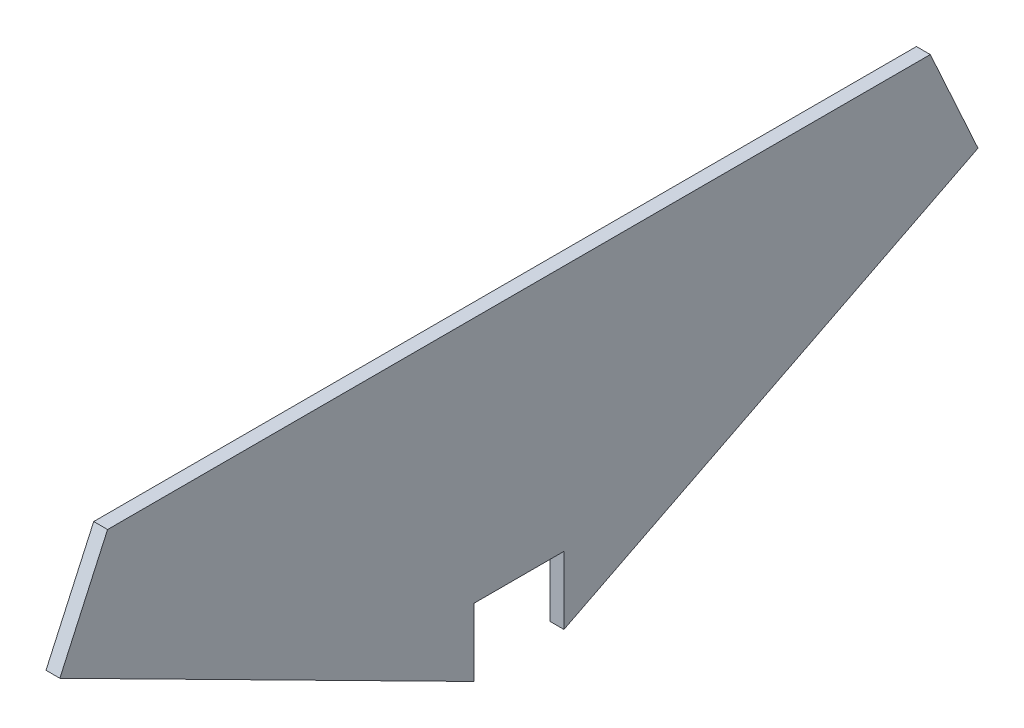
from build123d import *

# Parameters (mm, degrees)
BOSS_EXTRUDE1_DEPTH = 6


with BuildPart() as part:
    # Sketch1 → Boss-Extrude1 (new body)
    with BuildSketch(Plane(origin=(0, 0, 0), x_dir=(0, 0, -1), z_dir=(1, 0, 0))):
        Polygon((173.429755419, 75.110460295), (-182.858071121, 75.110460295), (-203.521174246, 29.651633419), (-24.214157851, -61.193638773), (-24.214157851, -31.889539705), (14.785842149, -31.889539705), (14.785842149, -61.193638773), (194.092858544, 29.651633419), align=None)
    extrude(amount=BOSS_EXTRUDE1_DEPTH)


solid = part.part
